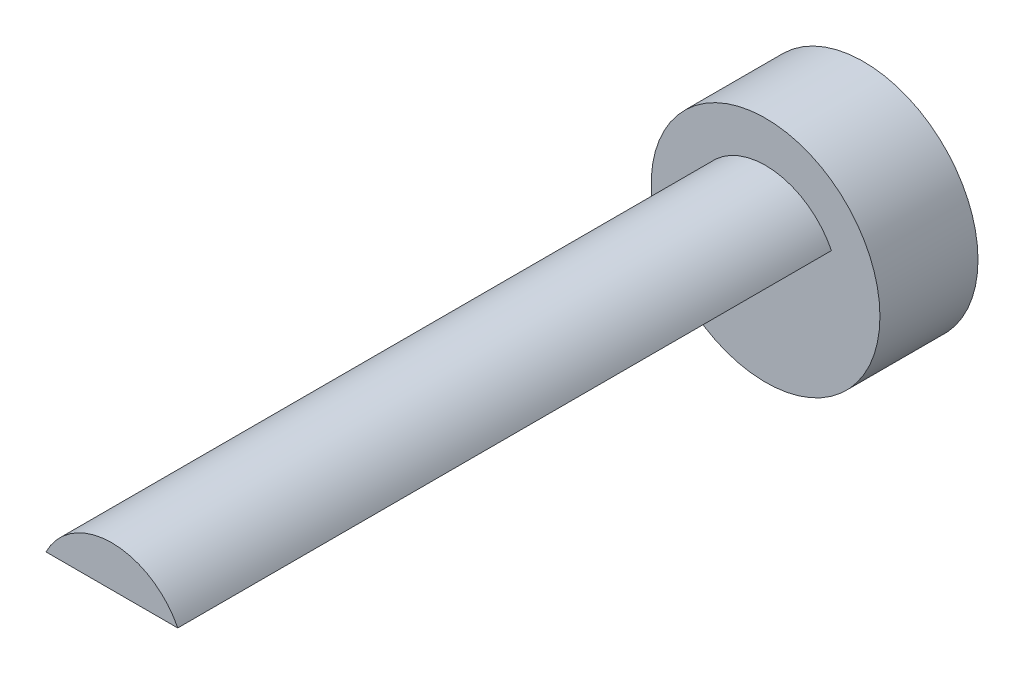
from build123d import *

# Parameters (mm, degrees)
BOSS_EXTRUDE1_DEPTH = 3
BOSS_EXTRUDE2_DEPTH = 20


with BuildPart() as part:
    # Sketch1 → Boss-Extrude1 (new body)
    with BuildSketch(Plane.XY):
        with BuildLine():
            ThreePointArc((3.354101966, 1), (0, 3.5), (-3.354101966, 1))
            Line((-3.354101966, 1), (3.354101966, 1))
        make_face()
        with BuildLine():
            Line((3.354101966, 1), (-3.354101966, 1))
            ThreePointArc((-3.354101966, 1), (-0.505293538, -3.463333429), (3.5, 0))
            ThreePointArc((3.5, 0), (3.463333429, 0.505293538), (3.354101966, 1))
        make_face()
    extrude(amount=BOSS_EXTRUDE1_DEPTH)

    # Sketch2 → Boss-Extrude2 (add)
    with BuildSketch(Plane.XY.offset(3)):
        with BuildLine():
            ThreePointArc((2.015564437, 1), (0, 2.25), (-2.015564437, 1))
            Line((-2.015564437, 1), (2.015564437, 1))
        make_face()
    extrude(amount=BOSS_EXTRUDE2_DEPTH)


solid = part.part
